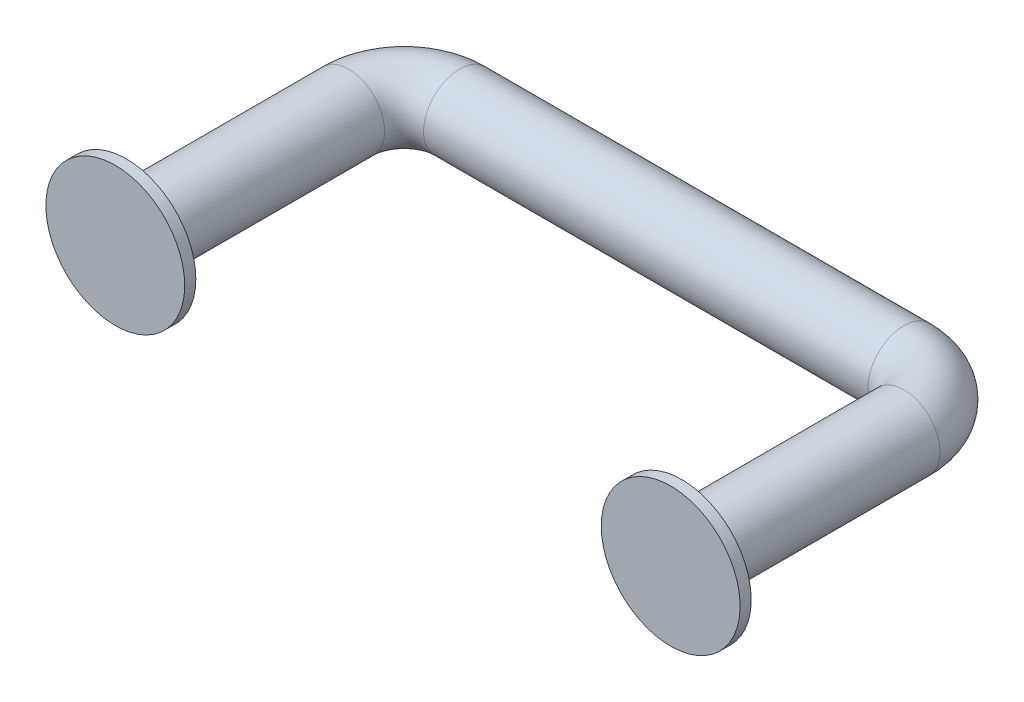
from build123d import *

# Parameters (mm, degrees)
BALAYAGE2_PROFILE_R = 6.5
BOSS_EXTRU_1_START  = 50
ESQUISSE15_R        = 12.5
BOSS_EXTRU_1_DEPTH  = 2


with BuildPart() as part:
    # Balayage2: sweep along a path in Esquisse1
    with BuildLine(Plane(origin=(0, 0, 0), x_dir=(1, 0, 0), z_dir=(0, 1, 0))) as balayage2_path:
        Line((50, -48.818897638), (50, -10))
        ThreePointArc((50, -10), (47.071067812, -2.928932188), (40, 0))
        Line((40, 0), (-40, 0))
        ThreePointArc((-40, 0), (-47.071067812, -2.928932188), (-50, -10))
        Line((-50, -10), (-50, -50))
    # Balayage2 profile (on start of the path) → Balayage2 (sweep)
    with BuildSketch(Plane(origin=(50, 0, 48.818897638), x_dir=(-1, 0, 0), z_dir=(0, 0, -1))):
        Circle(BALAYAGE2_PROFILE_R)
    sweep(path=balayage2_path.line)

    # Esquisse15 → Boss.-Extru.1 (add)
    with BuildSketch(Plane.XY.offset(BOSS_EXTRU_1_START)):
        with Locations((-50, 0)):
            Circle(ESQUISSE15_R)
        with Locations(Location((50, 0, 0), (0, 0, 180))):
            Circle(ESQUISSE15_R)
    extrude(amount=BOSS_EXTRU_1_DEPTH)


with BuildPart() as boss_extru_1_piece_1:
    # of the separate pieces the step leaves, piece 1, a body of its own (boss_extru_1_pieces)
    add(part.part.solids().sort_by_distance((-37.5, 0, 50))[0])


with BuildPart() as boss_extru_1_piece_2:
    # of the separate pieces the step leaves, piece 2, a body of its own (boss_extru_1_pieces)
    add(part.part.solids().sort_by_distance((37.5, 0, 50))[0])


solid = Compound([boss_extru_1_piece_1.part, boss_extru_1_piece_2.part])
